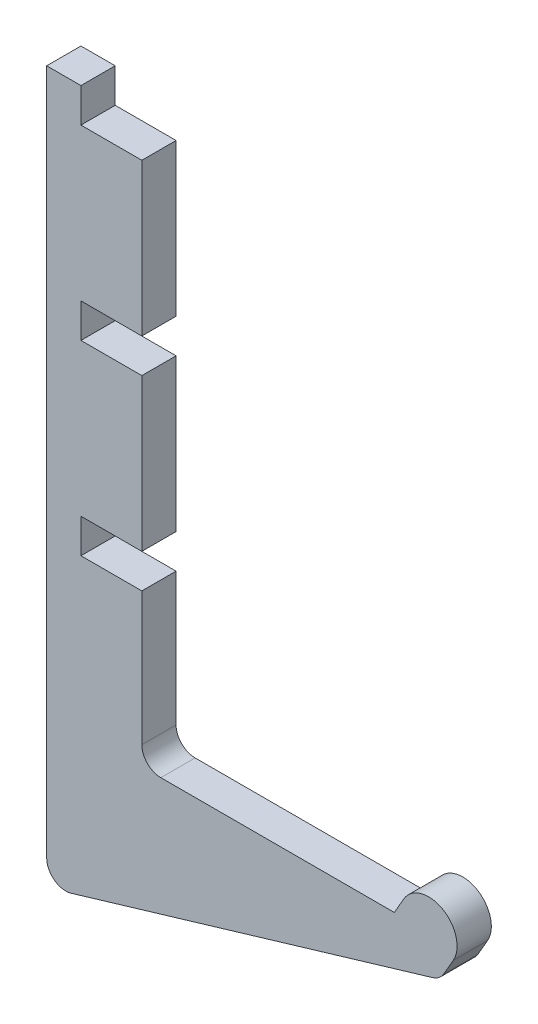
from build123d import *

# Parameters (mm, degrees)
BOSS_EXTRU_1_DEPTH      = 18
ESQUISSE2_W             = 32
ESQUISSE2_H             = 18
ENL_V_MAT_EXTRU_1_DEPTH = 650.168699184
BOSS_EXTRU_2_DEPTH      = 18


with BuildPart() as part:
    # Esquisse1 → Boss.-Extru.1 (new body)
    with BuildSketch(Plane.XY):
        with BuildLine():
            Line((0, 614), (0, 253.412385947))
            ThreePointArc((0, 253.412385947), (4.022705111, 245.395407351), (12.854389163, 243.82841691))
            Line((12.854389163, 243.82841691), (202.854389163, 300.416030963))
            ThreePointArc((202.854389163, 300.416030963), (209.895445679, 311.442274181), (200, 320))
            Line((200, 320), (60, 320))
            ThreePointArc((60, 320), (52.928932188, 322.928932188), (50, 330))
            Line((50, 330), (50, 614))
            Line((50, 614), (0, 614))
        make_face()
    extrude(amount=BOSS_EXTRU_1_DEPTH)

    # Esquisse2 → Enlèv. mat.-Extru.1 (cut, through all)
    with BuildSketch(Plane.XY.offset(18)):
        with Locations((34, 605)):
            Rectangle(ESQUISSE2_W, ESQUISSE2_H)
        with Locations((34, 507)):
            Rectangle(ESQUISSE2_W, ESQUISSE2_H)
        with Locations((34, 409)):
            Rectangle(ESQUISSE2_W, ESQUISSE2_H)
    extrude(amount=-ENL_V_MAT_EXTRU_1_DEPTH, mode=Mode.SUBTRACT)

    # Esquisse3 → Boss.-Extru.2 (add)
    with BuildSketch(Plane.XY.offset(18)):
        with BuildLine():
            Line((208.660254038, 305), (213.660254038, 313.660254038))
            ThreePointArc((213.660254038, 313.660254038), (208.169872981, 334.150635095), (187.679491924, 328.660254038))
            Line((187.679491924, 328.660254038), (182.679491924, 320))
            Line((182.679491924, 320), (208.660254038, 305))
        make_face()
    extrude(amount=-BOSS_EXTRU_2_DEPTH)


solid = part.part
